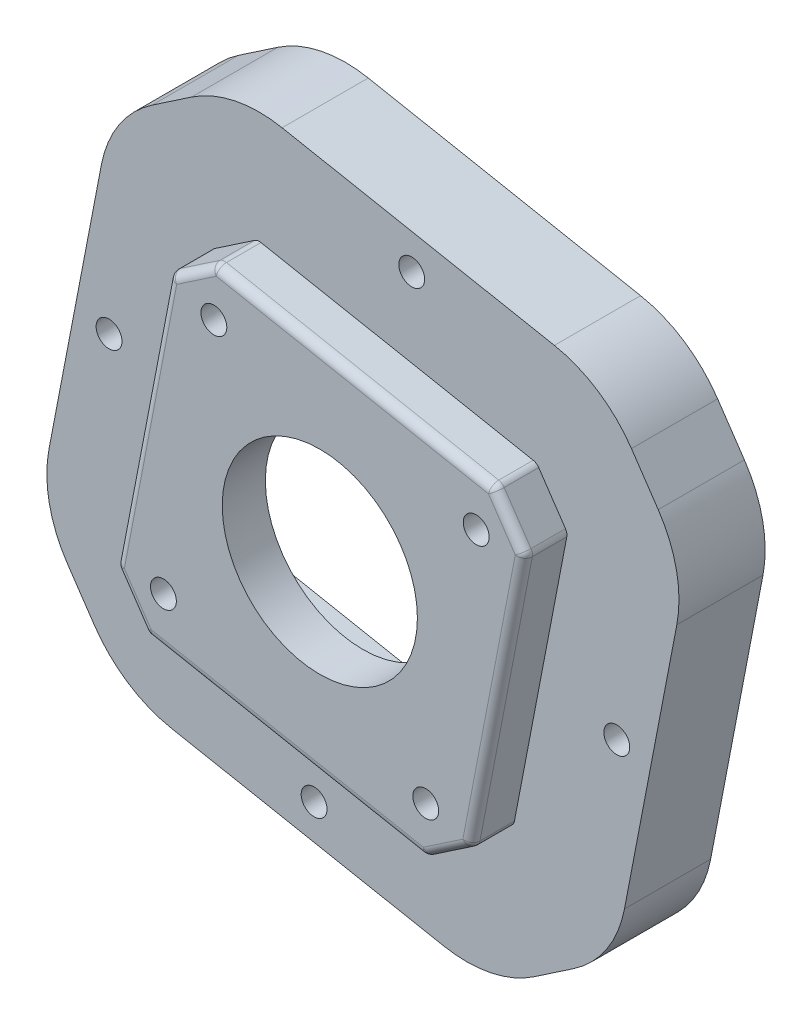
from build123d import *

# Parameters (mm, degrees)
BOSS_EXTRU_1_DEPTH      = 10
ESQUISSE4_R             = 1.5
ENL_V_MAT_EXTRU_1_DEPTH = 53.824995602
ESQUISSE5_R             = 1.5
ESQUISSE5_R_2           = 11.32290571
BOSS_EXTRU_2_DEPTH      = 5
CONG_3_R                = 1


with BuildPart() as part:
    # Esquisse2 → Boss.-Extru.1 (new body)
    with BuildSketch(Plane.XY):
        with BuildLine():
            Line((30.351150978, -22.216214596), (36.425687048, 9.37666677))
            ThreePointArc((36.425687048, 9.37666677), (36.390769011, 14.839084183), (34.268132307, 19.872337274))
            Line((34.268132307, 19.872337274), (31.163395971, 24.45521278))
            ThreePointArc((31.163395971, 24.45521278), (27.276192796, 28.293034393), (22.216214596, 30.351150978))
            Line((22.216214596, 30.351150978), (-9.37666677, 36.425687048))
            ThreePointArc((-9.37666677, 36.425687048), (-14.839084183, 36.390769011), (-19.872337274, 34.268132307))
            Line((-19.872337274, 34.268132307), (-24.45521278, 31.163395971))
            ThreePointArc((-24.45521278, 31.163395971), (-28.293034393, 27.276192796), (-30.351150978, 22.216214596))
            Line((-30.351150978, 22.216214596), (-36.425687048, -9.37666677))
            ThreePointArc((-36.425687048, -9.37666677), (-36.390769011, -14.839084183), (-34.268132307, -19.872337274))
            Line((-34.268132307, -19.872337274), (-31.163395971, -24.45521278))
            ThreePointArc((-31.163395971, -24.45521278), (-27.276192796, -28.293034393), (-22.216214596, -30.351150978))
            Line((-22.216214596, -30.351150978), (9.37666677, -36.425687048))
            ThreePointArc((9.37666677, -36.425687048), (14.839084183, -36.390769011), (19.872337274, -34.268132307))
            Line((19.872337274, -34.268132307), (24.45521278, -31.163395971))
            ThreePointArc((24.45521278, -31.163395971), (28.293034393, -27.276192796), (30.351150978, -22.216214596))
        make_face()
        with BuildLine():
            Line((19.761595182, 17.584990884), (-11.831286185, 23.659526955))
            ThreePointArc((-11.831286185, 23.659526955), (-12.221458858, 23.657032809), (-12.580976935, 23.505415902))
            Line((-12.580976935, 23.505415902), (-17.163852442, 20.400679566))
            ThreePointArc((-17.163852442, 20.400679566), (-17.437982557, 20.123022196), (-17.584990884, 19.761595182))
            Line((-17.584990884, 19.761595182), (-23.659526955, -11.831286185))
            ThreePointArc((-23.659526955, -11.831286185), (-23.657032809, -12.221458858), (-23.505415902, -12.580976935))
            Line((-23.505415902, -12.580976935), (-20.400679566, -17.163852442))
            ThreePointArc((-20.400679566, -17.163852442), (-20.123022196, -17.437982557), (-19.761595182, -17.584990884))
            Line((-19.761595182, -17.584990884), (11.831286185, -23.659526955))
            ThreePointArc((11.831286185, -23.659526955), (12.221458858, -23.657032809), (12.580976935, -23.505415902))
            Line((12.580976935, -23.505415902), (17.163852442, -20.400679566))
            ThreePointArc((17.163852442, -20.400679566), (17.437982557, -20.123022196), (17.584990884, -19.761595182))
            Line((17.584990884, -19.761595182), (23.659526955, 11.831286185))
            ThreePointArc((23.659526955, 11.831286185), (23.657032809, 12.221458858), (23.505415902, 12.580976935))
            Line((23.505415902, 12.580976935), (20.400679566, 17.163852442))
            ThreePointArc((20.400679566, 17.163852442), (20.123022196, 17.437982557), (19.761595182, 17.584990884))
        make_face(mode=Mode.SUBTRACT)
    extrude(amount=BOSS_EXTRU_1_DEPTH)

    # Esquisse4 → Enlèv. mat.-Extru.1 (cut, through all)
    with BuildSketch(Plane(origin=(0, 0, 0), x_dir=(-1, 0, 0), z_dir=(0, 0, -1))):
        with Locations((29.460369753, 5.664506401)):
            Circle(ESQUISSE4_R)
        with Locations((5.664506401, -29.460369753)):
            Circle(ESQUISSE4_R)
        with Locations((-29.460369753, -5.664506401)):
            Circle(ESQUISSE4_R)
        with Locations((-5.664506401, 29.460369753)):
            Circle(ESQUISSE4_R)
    extrude(amount=-ENL_V_MAT_EXTRU_1_DEPTH, mode=Mode.SUBTRACT)


with BuildPart() as body_2:
    # Esquisse5 → Boss.-Extru.2 (new body)
    with BuildSketch(Plane.XY.offset(10)):
        with BuildLine():
            ThreePointArc((17.163852442, -20.400679566), (17.437982557, -20.123022196), (17.584990884, -19.761595182))
            Line((17.584990884, -19.761595182), (23.659526955, 11.831286185))
            ThreePointArc((23.659526955, 11.831286185), (23.657032809, 12.221458858), (23.505415902, 12.580976935))
            Line((23.505415902, 12.580976935), (20.400679566, 17.163852442))
            ThreePointArc((20.400679566, 17.163852442), (20.123022196, 17.437982557), (19.761595182, 17.584990884))
            Line((19.761595182, 17.584990884), (-11.831286185, 23.659526955))
            ThreePointArc((-11.831286185, 23.659526955), (-12.221458858, 23.657032809), (-12.580976935, 23.505415902))
            Line((-12.580976935, 23.505415902), (-17.163852442, 20.400679566))
            ThreePointArc((-17.163852442, 20.400679566), (-17.437982557, 20.123022196), (-17.584990884, 19.761595182))
            Line((-17.584990884, 19.761595182), (-23.659526955, -11.831286185))
            ThreePointArc((-23.659526955, -11.831286185), (-23.657032809, -12.221458858), (-23.505415902, -12.580976935))
            Line((-23.505415902, -12.580976935), (-20.400679566, -17.163852442))
            ThreePointArc((-20.400679566, -17.163852442), (-20.123022196, -17.437982557), (-19.761595182, -17.584990884))
            Line((-19.761595182, -17.584990884), (11.831286185, -23.659526955))
            ThreePointArc((11.831286185, -23.659526955), (12.221458858, -23.657032809), (12.580976935, -23.505415902))
            Line((12.580976935, -23.505415902), (17.163852442, -20.400679566))
        make_face()
        with Locations((-18.14785249, -12.294529271)):
            Circle(ESQUISSE5_R, mode=Mode.SUBTRACT)
        with Locations((12.294529271, -18.14785249)):
            Circle(ESQUISSE5_R, mode=Mode.SUBTRACT)
        Circle(ESQUISSE5_R_2, mode=Mode.SUBTRACT)
        with Locations((-12.294529271, 18.14785249)):
            Circle(ESQUISSE5_R, mode=Mode.SUBTRACT)
        with Locations((18.14785249, 12.294529271)):
            Circle(ESQUISSE5_R, mode=Mode.SUBTRACT)
    extrude(amount=BOSS_EXTRU_2_DEPTH)

    # Congé3
    cong_3_edges = [body_2.edges().sort_by_distance(p)[0] for p in [
        (17.437982557, -20.123022196, 15),
        (20.62225892, -3.965154498, 15),
        (23.657032809, 12.221458858, 15),
        (21.953047734, 14.872414689, 15),
        (20.123022196, 17.437982557, 15),
        (3.965154498, 20.62225892, 15),
        (-12.221458858, 23.657032809, 15),
        (-14.872414689, 21.953047734, 15),
        (-17.437982557, 20.123022196, 15),
        (-20.62225892, 3.965154498, 15),
        (-23.657032809, -12.221458858, 15),
        (-21.953047734, -14.872414689, 15),
        (-20.123022196, -17.437982557, 15),
        (-3.965154498, -20.62225892, 15),
        (12.221458858, -23.657032809, 15),
        (14.872414689, -21.953047734, 15),
    ]]
    fillet(cong_3_edges, radius=CONG_3_R)


solid = Compound([part.part, body_2.part])
